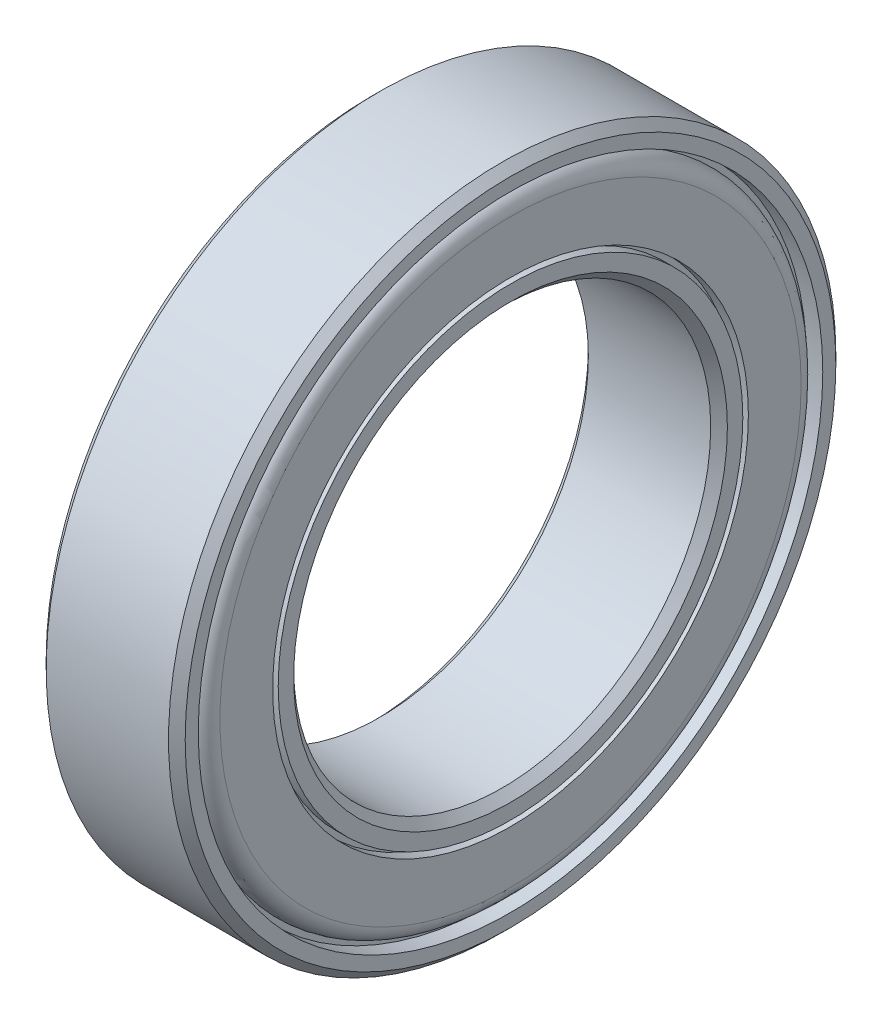
from build123d import *

# Parameters (mm, degrees)
SKETCH1_R           = 12
SKETCH1_R_2         = 7.5
BOSS_EXTRUDE1_DEPTH = 2.5
CHAMFER1_SIZE       = 0.3


with BuildPart() as part:
    # Sketch1 → Boss-Extrude1 (new, symmetric)
    with BuildSketch(Plane(origin=(0, 0, 0), x_dir=(0, 0, -1), z_dir=(1, 0, 0))):
        Circle(SKETCH1_R)
        Circle(SKETCH1_R_2, mode=Mode.SUBTRACT)
    extrude(amount=BOSS_EXTRUDE1_DEPTH, both=True)

    # Chamfer1
    chamfer1_edges = [part.edges().sort_by_distance(p)[0] for p in [
        (-2.5, 0, 12),
        (2.5, 0, 12),
        (-2.5, 0, 7.5),
        (2.5, 0, 7.5),
    ]]
    chamfer(chamfer1_edges, length=CHAMFER1_SIZE)

    # Sketch2 → Cut-Revolve1 (revolve, cut)
    with BuildSketch(Plane.XY, mode=Mode.PRIVATE) as cut_revolve1_sk:
        with BuildLine():
            Line((2.93973246, 11.230084286), (1.92076619, 11.230084286))
            Line((1.92076619, 11.230084286), (1.92076619, 11.030084286))
            ThreePointArc((1.92076619, 11.030084286), (2.330346345, 10.860430631), (2.5, 10.450850477))
            Line((2.5, 10.450850477), (2.5, 8.554548016))
            Line((2.5, 8.554548016), (2.084848677, 8.554548016))
            Line((2.084848677, 8.554548016), (2.084848677, 8.354548016))
            Line((2.084848677, 8.354548016), (2.93973246, 8.354548016))
            Line((2.93973246, 8.354548016), (2.93973246, 11.230084286))
        make_face()
    cut_revolve1 = revolve(cut_revolve1_sk.sketch.rotate(Axis((3.211719083, 0, 0), (-1, 0, 0)), 90), axis=Axis((3.211719083, 0, 0), (-1, 0, 0)), mode=Mode.SUBTRACT)

    # Mirror1: Cut-Revolve1 across plane
    add(cut_revolve1.mirror(Plane(origin=(0, 0, 0), x_dir=(0, 0, 1), z_dir=(1, 0, 0))), mode=Mode.SUBTRACT)


solid = part.part
